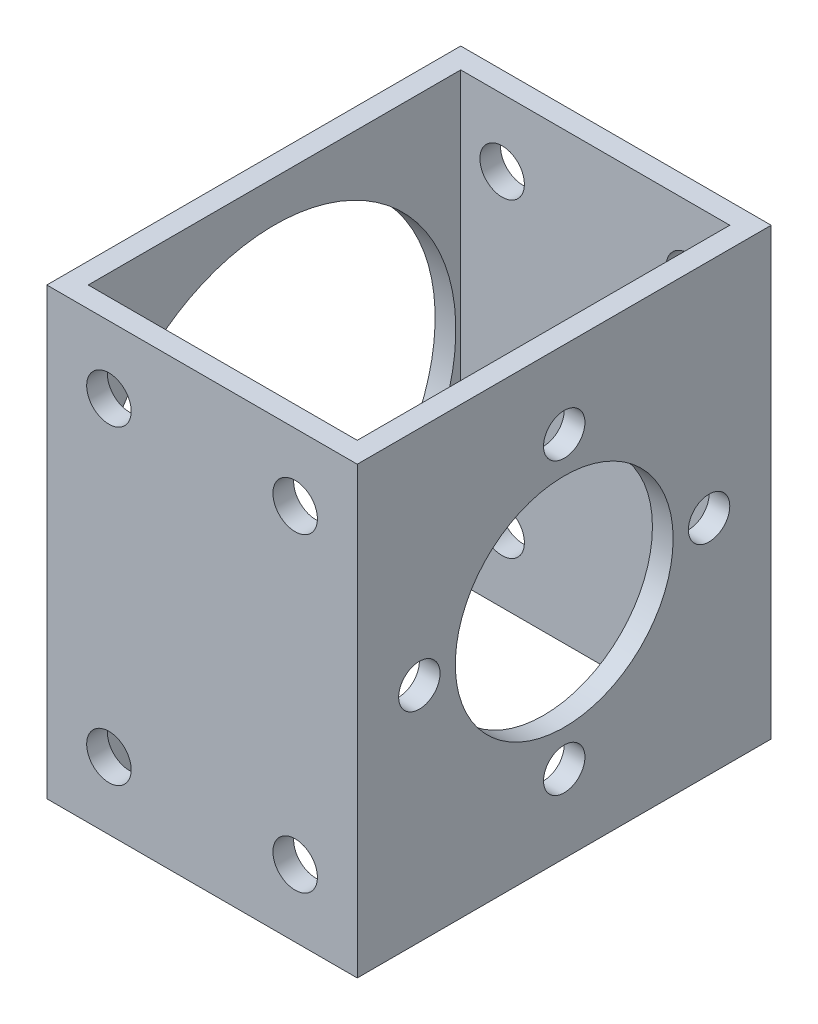
from build123d import *

# Parameters (mm, degrees)
SKETCH_1_W          = 30
SKETCH_1_H          = 40
SKETCH_1_W_2        = 26
SKETCH_1_H_2        = 36
EXTRUDE_1_DEPTH     = 43
SKETCH_2_R          = 2.15
CUT_EXTRUDE_1_DEPTH = 66.946948375
CUT_EXTRUDE_2_REACH = 67.947
SKETCH_3_R          = 17.525
CUT_EXTRUDE_3_REACH = 67.947
SKETCH_4_R          = 10.525
SKETCH_4_R_2        = 2


with BuildPart() as part:
    # 草图1 → 凸台-拉伸1 (new body)
    with BuildSketch(Plane(origin=(0, 0, 0), x_dir=(1, 0, 0), z_dir=(0, 1, 0))):
        with Locations((15, -20)):
            Rectangle(SKETCH_1_W, SKETCH_1_H)
        with Locations((15, -20)):
            Rectangle(SKETCH_1_W_2, SKETCH_1_H_2, mode=Mode.SUBTRACT)
    extrude(amount=EXTRUDE_1_DEPTH)

    # 草图2 → 切除-拉伸1 (cut, through all)
    with BuildSketch(Plane(origin=(0, 0, 0), x_dir=(-1, 0, 0), z_dir=(0, 0, -1))):
        with Locations((-6, 6.5)):
            Circle(SKETCH_2_R)
        with Locations((-24, 6.5)):
            Circle(SKETCH_2_R)
        with Locations((-24, 36.5)):
            Circle(SKETCH_2_R)
        with Locations((-6, 36.5)):
            Circle(SKETCH_2_R)
    extrude(amount=-CUT_EXTRUDE_1_DEPTH, mode=Mode.SUBTRACT)

    # 草图3 → 切除-拉伸2 (cut, up to next)
    with BuildSketch(Plane.ZY, mode=Mode.PRIVATE) as cut_extrude_2_sk1:
        with Locations((20, 21.5)):
            Circle(SKETCH_3_R)
    cut_extrude_2_tool1 = extrude(cut_extrude_2_sk1.sketch, amount=-CUT_EXTRUDE_2_REACH, mode=Mode.PRIVATE) & part.part
    add(cut_extrude_2_tool1.solids().sort_by_distance((0, 21.5, 20))[0], mode=Mode.SUBTRACT)

    # 草图4 → 切除-拉伸3 (cut, up to next)
    with BuildSketch(Plane(origin=(30, 0, 0), x_dir=(0, 0, -1), z_dir=(1, 0, 0)), mode=Mode.PRIVATE) as cut_extrude_3_sk1:
        with Locations((-20, 21.5)):
            Circle(SKETCH_4_R)
    cut_extrude_3_tool1 = extrude(cut_extrude_3_sk1.sketch, amount=-CUT_EXTRUDE_3_REACH, mode=Mode.PRIVATE) & part.part
    # 草图4 → 切除-拉伸3 (cut, up to next)
    with BuildSketch(Plane(origin=(30, 0, 0), x_dir=(0, 0, -1), z_dir=(1, 0, 0)), mode=Mode.PRIVATE) as cut_extrude_3_sk2:
        with Locations((-6, 21.5)):
            Circle(SKETCH_4_R_2)
    cut_extrude_3_tool2 = extrude(cut_extrude_3_sk2.sketch, amount=-CUT_EXTRUDE_3_REACH, mode=Mode.PRIVATE) & part.part
    # 草图4 → 切除-拉伸3 (cut, up to next)
    with BuildSketch(Plane(origin=(30, 0, 0), x_dir=(0, 0, -1), z_dir=(1, 0, 0)), mode=Mode.PRIVATE) as cut_extrude_3_sk3:
        with Locations((-20, 7.5)):
            Circle(SKETCH_4_R_2)
    cut_extrude_3_tool3 = extrude(cut_extrude_3_sk3.sketch, amount=-CUT_EXTRUDE_3_REACH, mode=Mode.PRIVATE) & part.part
    # 草图4 → 切除-拉伸3 (cut, up to next)
    with BuildSketch(Plane(origin=(30, 0, 0), x_dir=(0, 0, -1), z_dir=(1, 0, 0)), mode=Mode.PRIVATE) as cut_extrude_3_sk4:
        with Locations((-34, 21.5)):
            Circle(SKETCH_4_R_2)
    cut_extrude_3_tool4 = extrude(cut_extrude_3_sk4.sketch, amount=-CUT_EXTRUDE_3_REACH, mode=Mode.PRIVATE) & part.part
    # 草图4 → 切除-拉伸3 (cut, up to next)
    with BuildSketch(Plane(origin=(30, 0, 0), x_dir=(0, 0, -1), z_dir=(1, 0, 0)), mode=Mode.PRIVATE) as cut_extrude_3_sk5:
        with Locations((-20, 35.5)):
            Circle(SKETCH_4_R_2)
    cut_extrude_3_tool5 = extrude(cut_extrude_3_sk5.sketch, amount=-CUT_EXTRUDE_3_REACH, mode=Mode.PRIVATE) & part.part
    add(cut_extrude_3_tool1.solids().sort_by_distance((30, 21.5, 20))[0], mode=Mode.SUBTRACT)
    add(cut_extrude_3_tool2.solids().sort_by_distance((30, 21.5, 6))[0], mode=Mode.SUBTRACT)
    add(cut_extrude_3_tool3.solids().sort_by_distance((30, 7.5, 20))[0], mode=Mode.SUBTRACT)
    add(cut_extrude_3_tool4.solids().sort_by_distance((30, 21.5, 34))[0], mode=Mode.SUBTRACT)
    add(cut_extrude_3_tool5.solids().sort_by_distance((30, 35.5, 20))[0], mode=Mode.SUBTRACT)


solid = part.part
